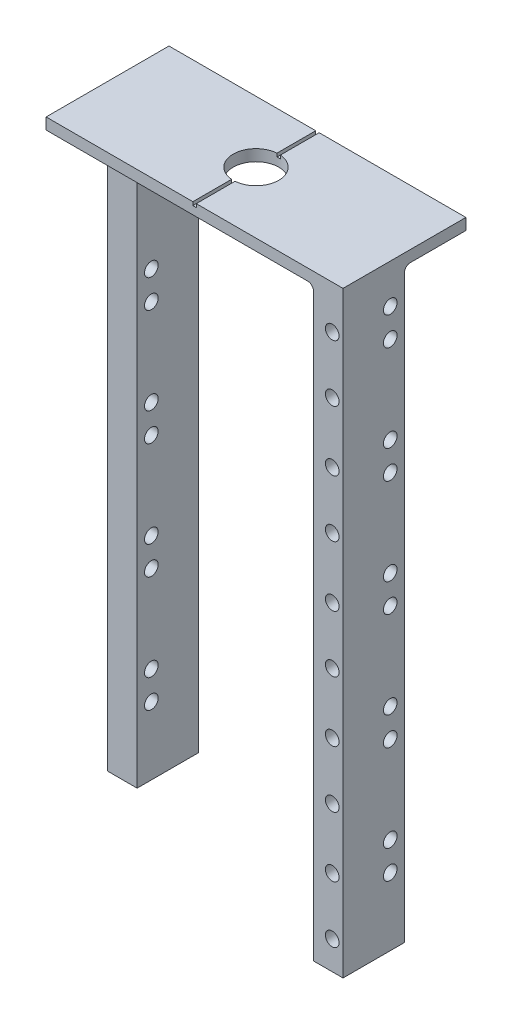
from build123d import *

# Parameters (mm, degrees)
SKETCH1_W              = 26.1
SKETCH1_H              = 10.8
EXTRUDE_284_DEPTH      = 1
SKETCH2_W              = 2.6
SKETCH2_H              = 5.4
EXTRUDE_422_DEPTH      = 51.5
SKETCH3_W              = 2.6
SKETCH3_H              = 5.4
EXTRUDE_634_DEPTH      = 51.5
SKETCH4_R              = 0.6
F_1_TIP_DEPTH          = 2
SKETCH5_R              = 0.6
F_2_TIP_DEPTH          = 2
SKETCH6_R              = 0.6
F_3_TIP_DEPTH          = 2
SKETCH7_R              = 0.6
F_4_TIP_DEPTH          = 2
SKETCH8_R              = 0.6
F_5_TIP_DEPTH          = 2
SKETCH9_R              = 0.6
F_6_TIP_DEPTH          = 2
SKETCH10_R             = 0.6
F_7_TIP_DEPTH          = 2
SKETCH11_R             = 0.6
F_8_TIP_DEPTH          = 2
SKETCH12_R             = 0.6
F_9_TIP_DEPTH          = 2
SKETCH13_R             = 0.6
F_10_TIP_DEPTH         = 2
SKETCH14_R             = 0.6
F_1_SAMPLE_DEPTH       = 2.6
SKETCH15_R             = 0.6
F_2_SAMPLE_DEPTH       = 2.6
SKETCH16_R             = 0.6
F_3_SAMPLE_DEPTH       = 2.6
SKETCH17_R             = 0.6
F_4_SAMPLE_DEPTH       = 2.6
SKETCH18_R             = 0.6
F_5_SAMPLE_DEPTH       = 2.6
SKETCH19_R             = 0.6
F_6_SAMPLE_DEPTH       = 2.6
SKETCH20_R             = 0.6
F_7_SAMPLE_DEPTH       = 2.6
SKETCH21_R             = 0.6
F_8_SAMPLE_DEPTH       = 2.6
SKETCH22_R             = 0.6
F_9_SAMPLE_DEPTH       = 2.6
SKETCH23_R             = 0.6
F_10_SAMPLE_DEPTH      = 2.6
SKETCH24_R             = 0.6
F_1_SAMPLE_2_DEPTH     = 2.6
SKETCH25_R             = 0.6
F_2_SAMPLE_2_DEPTH     = 2.6
SKETCH26_R             = 0.6
F_3_SAMPLE_2_DEPTH     = 2.6
SKETCH27_R             = 0.6
F_4_SAMPLE_2_DEPTH     = 2.6
SKETCH28_R             = 0.6
F_5_SAMPLE_2_DEPTH     = 2.6
SKETCH29_R             = 0.6
F_6_SAMPLE_2_DEPTH     = 2.6
SKETCH30_R             = 0.6
F_7_SAMPLE_2_DEPTH     = 2.6
SKETCH31_R             = 0.6
F_8_SAMPLE_2_DEPTH     = 2.6
SKETCH32_R             = 0.6
F_9_SAMPLE_2_DEPTH     = 2.6
SKETCH33_R             = 0.6
F_10_SAMPLE_2_DEPTH    = 2.6
SKETCH34_R             = 0.6
F_1_TIP_2_DEPTH        = 2
SKETCH35_R             = 0.6
F_2_TIP_2_DEPTH        = 2
SKETCH36_R             = 0.6
F_3_TIP_2_DEPTH        = 2
SKETCH37_R             = 0.6
F_4_TIP_2_DEPTH        = 2
SKETCH38_R             = 0.6
F_5_TIP_2_DEPTH        = 2
SKETCH39_R             = 0.6
F_6_TIP_2_DEPTH        = 2
SKETCH40_R             = 0.6
F_7_TIP_2_DEPTH        = 2
SKETCH41_R             = 0.6
F_8_TIP_2_DEPTH        = 2
SKETCH42_R             = 0.6
F_9_TIP_2_DEPTH        = 2
SKETCH43_R             = 0.6
F_10_TIP_2_DEPTH       = 2
SKETCH44_R             = 2
CUT_EXTRUDE_M4_DEPTH   = 3
FILLET1_R              = 0.5
FILLET2_R              = 0.5
SKETCH45_W             = 0.3
SKETCH45_H             = 10.8
CUT_EXTRUDE_9209_DEPTH = 0.3


with BuildPart() as part:
    # Sketch1 → Extrude 284 (new body)
    with BuildSketch(Plane(origin=(0, 0, 0), x_dir=(1, 0, 0), z_dir=(0, 1, 0))):
        Rectangle(SKETCH1_W, SKETCH1_H)
    extrude(amount=-EXTRUDE_284_DEPTH)

    # Sketch2 → Extrude 422 (add)
    with BuildSketch(Plane.XZ.offset(1)):
        with Locations((11.75, 2.7)):
            Rectangle(SKETCH2_W, SKETCH2_H)
    extrude(amount=EXTRUDE_422_DEPTH)

    # Sketch3 → Extrude 634 (add)
    with BuildSketch(Plane.XZ.offset(1)):
        with Locations((-11.75, -2.7)):
            Rectangle(SKETCH3_W, SKETCH3_H)
    extrude(amount=EXTRUDE_634_DEPTH)

    # Sketch4 → 1-tip (cut)
    with BuildSketch(Plane.XY.offset(5.4)):
        with Locations((12.1, -3.8)):
            Circle(SKETCH4_R)
    extrude(amount=-F_1_TIP_DEPTH, mode=Mode.SUBTRACT)

    # Sketch5 → 2-tip (cut)
    with BuildSketch(Plane.XY.offset(5.4)):
        with Locations((12.1, -8.8)):
            Circle(SKETCH5_R)
    extrude(amount=-F_2_TIP_DEPTH, mode=Mode.SUBTRACT)

    # Sketch6 → 3-tip (cut)
    with BuildSketch(Plane.XY.offset(5.4)):
        with Locations((12.1, -14.1)):
            Circle(SKETCH6_R)
    extrude(amount=-F_3_TIP_DEPTH, mode=Mode.SUBTRACT)

    # Sketch7 → 4-tip (cut)
    with BuildSketch(Plane.XY.offset(5.4)):
        with Locations((12.1, -19.1)):
            Circle(SKETCH7_R)
    extrude(amount=-F_4_TIP_DEPTH, mode=Mode.SUBTRACT)

    # Sketch8 → 5-tip (cut)
    with BuildSketch(Plane.XY.offset(5.4)):
        with Locations((12.1, -24.4)):
            Circle(SKETCH8_R)
    extrude(amount=-F_5_TIP_DEPTH, mode=Mode.SUBTRACT)

    # Sketch9 → 6-tip (cut)
    with BuildSketch(Plane.XY.offset(5.4)):
        with Locations((12.1, -29.4)):
            Circle(SKETCH9_R)
    extrude(amount=-F_6_TIP_DEPTH, mode=Mode.SUBTRACT)

    # Sketch10 → 7-tip (cut)
    with BuildSketch(Plane.XY.offset(5.4)):
        with Locations((12.1, -34.7)):
            Circle(SKETCH10_R)
    extrude(amount=-F_7_TIP_DEPTH, mode=Mode.SUBTRACT)

    # Sketch11 → 8-tip (cut)
    with BuildSketch(Plane.XY.offset(5.4)):
        with Locations((12.1, -39.7)):
            Circle(SKETCH11_R)
    extrude(amount=-F_8_TIP_DEPTH, mode=Mode.SUBTRACT)

    # Sketch12 → 9-tip (cut)
    with BuildSketch(Plane.XY.offset(5.4)):
        with Locations((12.1, -45)):
            Circle(SKETCH12_R)
    extrude(amount=-F_9_TIP_DEPTH, mode=Mode.SUBTRACT)

    # Sketch13 → 10-tip (cut)
    with BuildSketch(Plane.XY.offset(5.4)):
        with Locations((12.1, -50)):
            Circle(SKETCH13_R)
    extrude(amount=-F_10_TIP_DEPTH, mode=Mode.SUBTRACT)

    # Sketch14 → 1-sample (cut)
    with BuildSketch(Plane.ZY.offset(-10.45)):
        with Locations((1.25, -3.45)):
            Circle(SKETCH14_R)
    extrude(amount=-F_1_SAMPLE_DEPTH, mode=Mode.SUBTRACT)

    # Sketch15 → 2-sample (cut)
    with BuildSketch(Plane.ZY.offset(-10.45)):
        with Locations((1.25, -5.95)):
            Circle(SKETCH15_R)
    extrude(amount=-F_2_SAMPLE_DEPTH, mode=Mode.SUBTRACT)

    # Sketch16 → 3-sample (cut)
    with BuildSketch(Plane.ZY.offset(-10.45)):
        with Locations((1.25, -13.6)):
            Circle(SKETCH16_R)
    extrude(amount=-F_3_SAMPLE_DEPTH, mode=Mode.SUBTRACT)

    # Sketch17 → 4-sample (cut)
    with BuildSketch(Plane.ZY.offset(-10.45)):
        with Locations((1.25, -16.1)):
            Circle(SKETCH17_R)
    extrude(amount=-F_4_SAMPLE_DEPTH, mode=Mode.SUBTRACT)

    # Sketch18 → 5-sample (cut)
    with BuildSketch(Plane.ZY.offset(-10.45)):
        with Locations((1.25, -23.75)):
            Circle(SKETCH18_R)
    extrude(amount=-F_5_SAMPLE_DEPTH, mode=Mode.SUBTRACT)

    # Sketch19 → 6-sample (cut)
    with BuildSketch(Plane.ZY.offset(-10.45)):
        with Locations((1.25, -26.25)):
            Circle(SKETCH19_R)
    extrude(amount=-F_6_SAMPLE_DEPTH, mode=Mode.SUBTRACT)

    # Sketch20 → 7-sample (cut)
    with BuildSketch(Plane.ZY.offset(-10.45)):
        with Locations((1.25, -33.9)):
            Circle(SKETCH20_R)
    extrude(amount=-F_7_SAMPLE_DEPTH, mode=Mode.SUBTRACT)

    # Sketch21 → 8-sample (cut)
    with BuildSketch(Plane.ZY.offset(-10.45)):
        with Locations((1.25, -36.4)):
            Circle(SKETCH21_R)
    extrude(amount=-F_8_SAMPLE_DEPTH, mode=Mode.SUBTRACT)

    # Sketch22 → 9-sample (cut)
    with BuildSketch(Plane.ZY.offset(-10.45)):
        with Locations((1.25, -44.05)):
            Circle(SKETCH22_R)
    extrude(amount=-F_9_SAMPLE_DEPTH, mode=Mode.SUBTRACT)

    # Sketch23 → 10-sample (cut)
    with BuildSketch(Plane.ZY.offset(-10.45)):
        with Locations((1.25, -46.55)):
            Circle(SKETCH23_R)
    extrude(amount=-F_10_SAMPLE_DEPTH, mode=Mode.SUBTRACT)

    # Sketch24 → 1-sample 2 (cut)
    with BuildSketch(Plane(origin=(-10.45, 0, 0), x_dir=(0, 0, -1), z_dir=(1, 0, 0))):
        with Locations((1.25, -3.45)):
            Circle(SKETCH24_R)
    extrude(amount=-F_1_SAMPLE_2_DEPTH, mode=Mode.SUBTRACT)

    # Sketch25 → 2-sample 2 (cut)
    with BuildSketch(Plane(origin=(-10.45, 0, 0), x_dir=(0, 0, -1), z_dir=(1, 0, 0))):
        with Locations((1.25, -5.95)):
            Circle(SKETCH25_R)
    extrude(amount=-F_2_SAMPLE_2_DEPTH, mode=Mode.SUBTRACT)

    # Sketch26 → 3-sample 2 (cut)
    with BuildSketch(Plane(origin=(-10.45, 0, 0), x_dir=(0, 0, -1), z_dir=(1, 0, 0))):
        with Locations((1.25, -13.6)):
            Circle(SKETCH26_R)
    extrude(amount=-F_3_SAMPLE_2_DEPTH, mode=Mode.SUBTRACT)

    # Sketch27 → 4-sample 2 (cut)
    with BuildSketch(Plane(origin=(-10.45, 0, 0), x_dir=(0, 0, -1), z_dir=(1, 0, 0))):
        with Locations((1.25, -16.1)):
            Circle(SKETCH27_R)
    extrude(amount=-F_4_SAMPLE_2_DEPTH, mode=Mode.SUBTRACT)

    # Sketch28 → 5-sample 2 (cut)
    with BuildSketch(Plane(origin=(-10.45, 0, 0), x_dir=(0, 0, -1), z_dir=(1, 0, 0))):
        with Locations((1.25, -23.75)):
            Circle(SKETCH28_R)
    extrude(amount=-F_5_SAMPLE_2_DEPTH, mode=Mode.SUBTRACT)

    # Sketch29 → 6-sample 2 (cut)
    with BuildSketch(Plane(origin=(-10.45, 0, 0), x_dir=(0, 0, -1), z_dir=(1, 0, 0))):
        with Locations((1.25, -26.25)):
            Circle(SKETCH29_R)
    extrude(amount=-F_6_SAMPLE_2_DEPTH, mode=Mode.SUBTRACT)

    # Sketch30 → 7-sample 2 (cut)
    with BuildSketch(Plane(origin=(-10.45, 0, 0), x_dir=(0, 0, -1), z_dir=(1, 0, 0))):
        with Locations((1.25, -33.9)):
            Circle(SKETCH30_R)
    extrude(amount=-F_7_SAMPLE_2_DEPTH, mode=Mode.SUBTRACT)

    # Sketch31 → 8-sample 2 (cut)
    with BuildSketch(Plane(origin=(-10.45, 0, 0), x_dir=(0, 0, -1), z_dir=(1, 0, 0))):
        with Locations((1.25, -36.4)):
            Circle(SKETCH31_R)
    extrude(amount=-F_8_SAMPLE_2_DEPTH, mode=Mode.SUBTRACT)

    # Sketch32 → 9-sample 2 (cut)
    with BuildSketch(Plane(origin=(-10.45, 0, 0), x_dir=(0, 0, -1), z_dir=(1, 0, 0))):
        with Locations((1.25, -44.05)):
            Circle(SKETCH32_R)
    extrude(amount=-F_9_SAMPLE_2_DEPTH, mode=Mode.SUBTRACT)

    # Sketch33 → 10-sample 2 (cut)
    with BuildSketch(Plane(origin=(-10.45, 0, 0), x_dir=(0, 0, -1), z_dir=(1, 0, 0))):
        with Locations((1.25, -46.55)):
            Circle(SKETCH33_R)
    extrude(amount=-F_10_SAMPLE_2_DEPTH, mode=Mode.SUBTRACT)

    # Sketch34 → 1-tip 2 (cut)
    with BuildSketch(Plane(origin=(0, 0, -5.4), x_dir=(-1, 0, 0), z_dir=(0, 0, -1))):
        with Locations((12.1, -3.8)):
            Circle(SKETCH34_R)
    extrude(amount=-F_1_TIP_2_DEPTH, mode=Mode.SUBTRACT)

    # Sketch35 → 2-tip 2 (cut)
    with BuildSketch(Plane(origin=(0, 0, -5.4), x_dir=(-1, 0, 0), z_dir=(0, 0, -1))):
        with Locations((12.1, -8.8)):
            Circle(SKETCH35_R)
    extrude(amount=-F_2_TIP_2_DEPTH, mode=Mode.SUBTRACT)

    # Sketch36 → 3-tip 2 (cut)
    with BuildSketch(Plane(origin=(0, 0, -5.4), x_dir=(-1, 0, 0), z_dir=(0, 0, -1))):
        with Locations((12.1, -14.1)):
            Circle(SKETCH36_R)
    extrude(amount=-F_3_TIP_2_DEPTH, mode=Mode.SUBTRACT)

    # Sketch37 → 4-tip 2 (cut)
    with BuildSketch(Plane(origin=(0, 0, -5.4), x_dir=(-1, 0, 0), z_dir=(0, 0, -1))):
        with Locations((12.1, -19.1)):
            Circle(SKETCH37_R)
    extrude(amount=-F_4_TIP_2_DEPTH, mode=Mode.SUBTRACT)

    # Sketch38 → 5-tip 2 (cut)
    with BuildSketch(Plane(origin=(0, 0, -5.4), x_dir=(-1, 0, 0), z_dir=(0, 0, -1))):
        with Locations((12.1, -24.4)):
            Circle(SKETCH38_R)
    extrude(amount=-F_5_TIP_2_DEPTH, mode=Mode.SUBTRACT)

    # Sketch39 → 6-tip 2 (cut)
    with BuildSketch(Plane(origin=(0, 0, -5.4), x_dir=(-1, 0, 0), z_dir=(0, 0, -1))):
        with Locations((12.1, -29.4)):
            Circle(SKETCH39_R)
    extrude(amount=-F_6_TIP_2_DEPTH, mode=Mode.SUBTRACT)

    # Sketch40 → 7-tip 2 (cut)
    with BuildSketch(Plane(origin=(0, 0, -5.4), x_dir=(-1, 0, 0), z_dir=(0, 0, -1))):
        with Locations((12.1, -34.7)):
            Circle(SKETCH40_R)
    extrude(amount=-F_7_TIP_2_DEPTH, mode=Mode.SUBTRACT)

    # Sketch41 → 8-tip 2 (cut)
    with BuildSketch(Plane(origin=(0, 0, -5.4), x_dir=(-1, 0, 0), z_dir=(0, 0, -1))):
        with Locations((12.1, -39.7)):
            Circle(SKETCH41_R)
    extrude(amount=-F_8_TIP_2_DEPTH, mode=Mode.SUBTRACT)

    # Sketch42 → 9-tip 2 (cut)
    with BuildSketch(Plane(origin=(0, 0, -5.4), x_dir=(-1, 0, 0), z_dir=(0, 0, -1))):
        with Locations((12.1, -45)):
            Circle(SKETCH42_R)
    extrude(amount=-F_9_TIP_2_DEPTH, mode=Mode.SUBTRACT)

    # Sketch43 → 10-tip 2 (cut)
    with BuildSketch(Plane(origin=(0, 0, -5.4), x_dir=(-1, 0, 0), z_dir=(0, 0, -1))):
        with Locations((12.1, -50)):
            Circle(SKETCH43_R)
    extrude(amount=-F_10_TIP_2_DEPTH, mode=Mode.SUBTRACT)

    # Sketch44 → M4螺絲孔 (cut)
    with BuildSketch(Plane(origin=(0, 0, 0), x_dir=(1, 0, 0), z_dir=(0, 1, 0))):
        Circle(SKETCH44_R)
    extrude(amount=-CUT_EXTRUDE_M4_DEPTH, mode=Mode.SUBTRACT)

    # Fillet1
    fillet1_edges = [part.edges().sort_by_distance(p)[0] for p in [
        (10.45, -1, 2.7),
        (-10.45, -1, -2.7),
    ]]
    fillet(fillet1_edges, radius=FILLET1_R)

    # Fillet2
    fillet2_edges = [part.edges().sort_by_distance(p)[0] for p in [
        (11.5, -1, 0),
        (-11.5, -1, 0),
    ]]
    fillet(fillet2_edges, radius=FILLET2_R)

    # Sketch45 → Cut-Extrude 9209 (cut)
    with BuildSketch(Plane(origin=(0, 0, 0), x_dir=(1, 0, 0), z_dir=(0, 1, 0))):
        Rectangle(SKETCH45_W, SKETCH45_H)
    extrude(amount=-CUT_EXTRUDE_9209_DEPTH, mode=Mode.SUBTRACT)


solid = part.part
